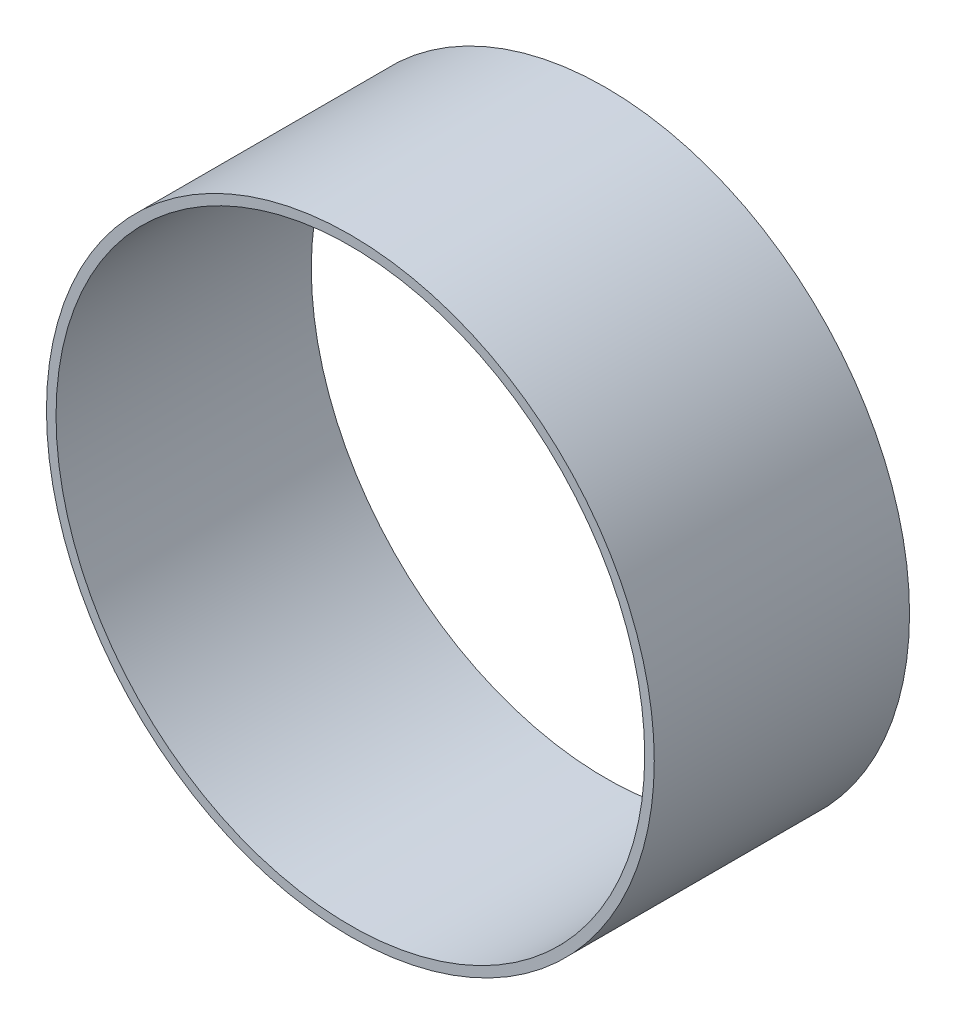
from build123d import *

# Parameters (mm, degrees)
ROTOR_SHELL_START = -40
SKETCH_1_R        = 95.246153846
SKETCH_1_R_2      = 92.246153846
ROTOR_SHELL_DEPTH = 80


with BuildPart() as part:
    # Эскиз1 → Rotor_shell (new body)
    with BuildSketch(Plane.XY.offset(ROTOR_SHELL_START)):
        Circle(SKETCH_1_R)
        Circle(SKETCH_1_R_2, mode=Mode.SUBTRACT)
    extrude(amount=ROTOR_SHELL_DEPTH)


solid = part.part
